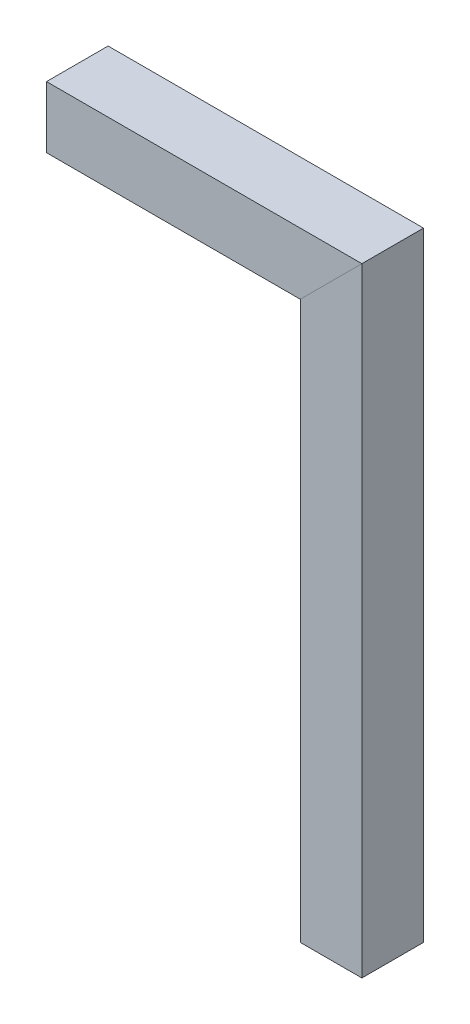
from build123d import *

# Parameters (mm, degrees)
HIERRO_ANGULAR_2_X_2_X_0_125_1_DEPTH        = 582.842048969
HIERRO_ANGULAR_2_X_2_X_0_125_1_2_DEPTH      = 260
HIERRO_ANGULAR_2_X_2_X_0_125_1_2_DEPTH_BACK = 72.842048969


with BuildPart() as part:
    # Sketch1 on segment 1 (carried to segment 1) → Hierro angular 2 X 2 X 0.125(1) (new body)
    with BuildSketch(Plane(origin=(0, -510, 0), x_dir=(0, 0, -1), z_dir=(0, 1, 0))):
        with BuildLine():
            Line((0, 0), (0, 50.8))
            Line((0, 50.8), (0.00508, 50.8))
            ThreePointArc((0.00508, 50.8), (2.246551928, 49.871551928), (3.175, 47.63008))
            Line((3.175, 47.63008), (3.175, 7.9375))
            ThreePointArc((3.175, 7.9375), (4.569903955, 4.569903955), (7.9375, 3.175))
            Line((7.9375, 3.175), (47.63008, 3.175))
            ThreePointArc((47.63008, 3.175), (49.871551928, 2.246551928), (50.8, 0.00508))
            Line((50.8, 0.00508), (50.8, 0))
            Line((50.8, 0), (0, 0))
        make_face()
    extrude(amount=HIERRO_ANGULAR_2_X_2_X_0_125_1_DEPTH)

    # Hierro angular 2 X 2 X 0.125(1) mitre 1
    split(bisect_by=Plane(origin=(0, 0, 0), x_dir=(0.707106781, 0.707106781, 0), z_dir=(0.707106781, -0.707106781, 0)), keep=Keep.TOP)


with BuildPart() as body_2:
    # Sketch1 → Hierro angular 2 X 2 X 0.125_1 2 (new, two sides: drawn at the far end of the back side and taken through both)
    with BuildSketch(Plane(origin=(0, 0, 0), x_dir=(0, 0, -1), z_dir=(-1, 0, 0)).offset(-HIERRO_ANGULAR_2_X_2_X_0_125_1_2_DEPTH_BACK)):
        with BuildLine():
            Line((0, 0), (0, 50.8))
            Line((0, 50.8), (0.00508, 50.8))
            ThreePointArc((0.00508, 50.8), (2.246551928, 49.871551928), (3.175, 47.63008))
            Line((3.175, 47.63008), (3.175, 7.9375))
            ThreePointArc((3.175, 7.9375), (4.569903955, 4.569903955), (7.9375, 3.175))
            Line((7.9375, 3.175), (47.63008, 3.175))
            ThreePointArc((47.63008, 3.175), (49.871551928, 2.246551928), (50.8, 0.00508))
            Line((50.8, 0.00508), (50.8, 0))
            Line((50.8, 0), (0, 0))
        make_face()
    extrude(amount=HIERRO_ANGULAR_2_X_2_X_0_125_1_2_DEPTH + HIERRO_ANGULAR_2_X_2_X_0_125_1_2_DEPTH_BACK)

    # Hierro angular 2 X 2 X 0.125_1 2 mitre 1
    split(bisect_by=Plane(origin=(0, 0, 0), x_dir=(-0.707106781, -0.707106781, 0), z_dir=(-0.707106781, 0.707106781, 0)), keep=Keep.TOP)


solid = Compound([part.part, body_2.part])
